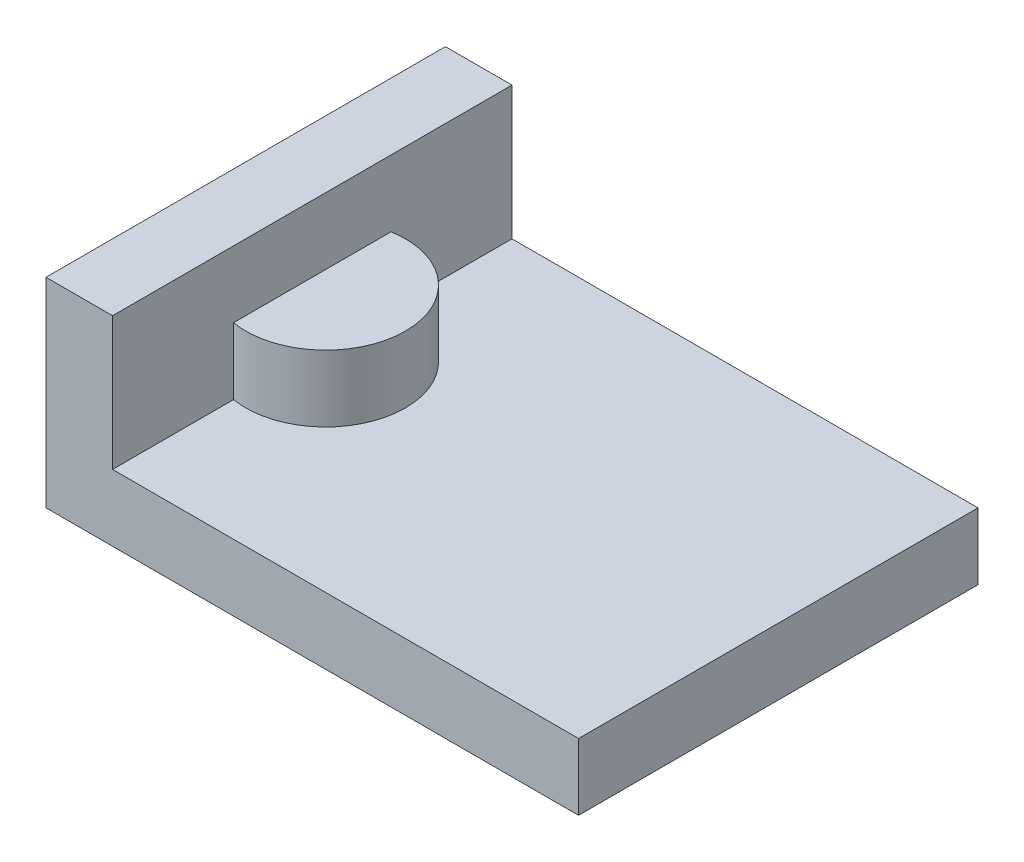
from build123d import *

# Parameters (mm, degrees)
SKETCH1_W           = 80
SKETCH1_H           = 60
BOSS_EXTRUDE1_DEPTH = 10
SKETCH2_W           = 10
SKETCH2_H           = 60
BOSS_EXTRUDE2_DEPTH = 30
SKETCH3_R           = 12
BOSS_EXTRUDE3_DEPTH = 20


with BuildPart() as part:
    # Sketch1 → Boss-Extrude1 (new body)
    with BuildSketch(Plane(origin=(0, 0, 0), x_dir=(1, 0, 0), z_dir=(0, 1, 0))):
        Rectangle(SKETCH1_W, SKETCH1_H)
    extrude(amount=BOSS_EXTRUDE1_DEPTH)

    # Sketch2 → Boss-Extrude2 (add)
    with BuildSketch(Plane(origin=(0, 0, 0), x_dir=(1, 0, 0), z_dir=(0, 1, 0))):
        with Locations((-35, 0)):
            Rectangle(SKETCH2_W, SKETCH2_H)
    extrude(amount=BOSS_EXTRUDE2_DEPTH)

    # Sketch3 → Boss-Extrude3 (add)
    with BuildSketch(Plane(origin=(0, 0, 0), x_dir=(1, 0, 0), z_dir=(0, 1, 0))):
        with Locations((-28, 0)):
            Circle(SKETCH3_R)
    extrude(amount=BOSS_EXTRUDE3_DEPTH)


solid = part.part
